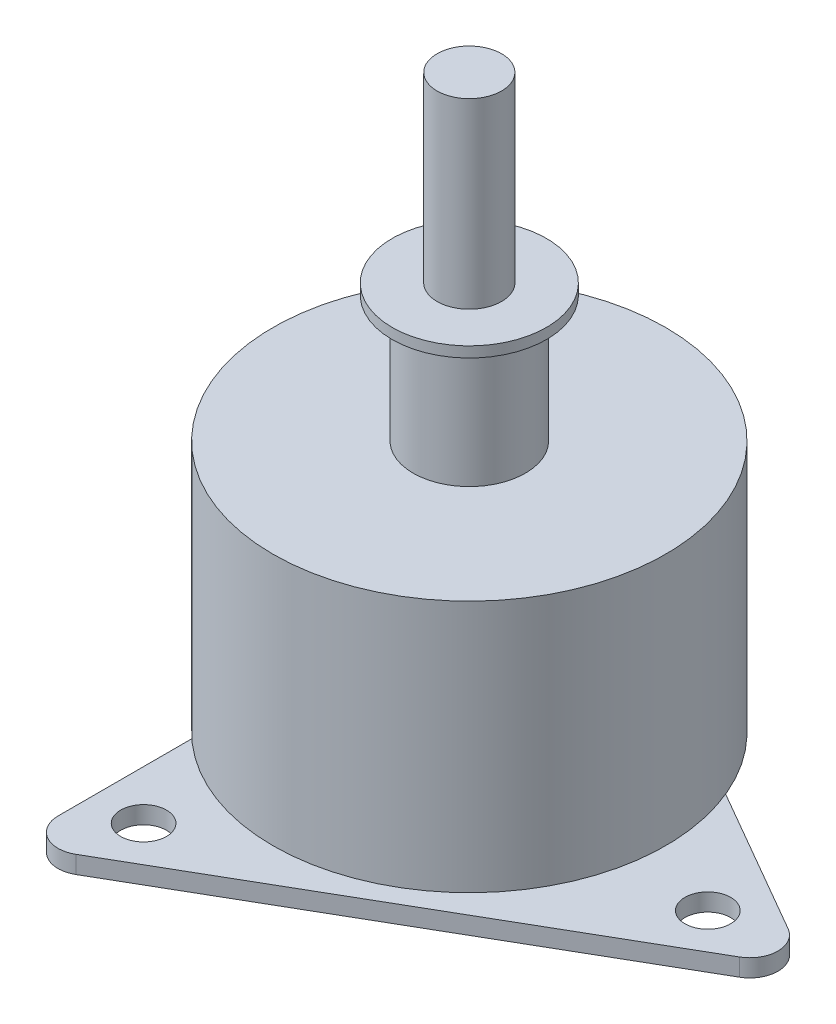
from build123d import *

# Parameters (mm, degrees)
BOSS_EXTRUDE1_DEPTH   = 1.25
F_4_CLEARANCE_HOLE1_D = 3.2639
SKETCH5_R             = 7.5
BOSS_EXTRUDE2_DEPTH   = 3.25
FILLET2_R             = 2


with BuildPart() as part:
    # Sketch1 → Boss-Extrude1 (new body)
    with BuildSketch(Plane(origin=(0, 0, 0), x_dir=(1, 0, 0), z_dir=(0, 1, 0))):
        Polygon((24, 0), (-12, 20.784609691), (-12, -20.784609691), align=None)
    extrude(amount=BOSS_EXTRUDE1_DEPTH)

    # #4 Clearance Hole1 (through all)
    with Locations(Plane(origin=(0, 1.25, 0), x_dir=(1, 0, 0), z_dir=(0, 1, 0))):
        with Locations((-8.5, 14.722431864), (-8.5, -14.722431864), (17, 0)):
            Hole(F_4_CLEARANCE_HOLE1_D / 2)

    # Sketch4 → Revolve1 (revolve)
    with BuildSketch(Plane(origin=(0, 0, 0), x_dir=(0, 0, -1), z_dir=(1, 0, 0)), mode=Mode.PRIVATE) as revolve1_sk:
        Polygon((0, 1.25), (6, 1.25), (6, 3.75), (14, 3.75), (14, 21.75), (4, 21.75), (4, 30.75), (5.5, 30.75), (5.5, 31.5), (2.3, 31.5), (2.3, 44.5), (0, 44.5), align=None)
    revolve(revolve1_sk.sketch.rotate(Axis((0, 44.5, 0), (0, -1, 0)), 180), axis=Axis((0, 44.5, 0), (0, -1, 0)))

    # Sketch5 → Boss-Extrude2 (add)
    with BuildSketch(Plane.XZ):
        with Locations(Location((0, 0, 0), (0, 0, 90))):
            Circle(SKETCH5_R)
    extrude(amount=BOSS_EXTRUDE2_DEPTH)

    # Fillet2
    fillet2_edges = [part.edges().sort_by_distance(p)[0] for p in [
        (-12, 0.625, 20.784609691),
        (-12, 0.625, -20.784609691),
        (24, 0.625, 0),
    ]]
    fillet(fillet2_edges, radius=FILLET2_R)


solid = part.part
